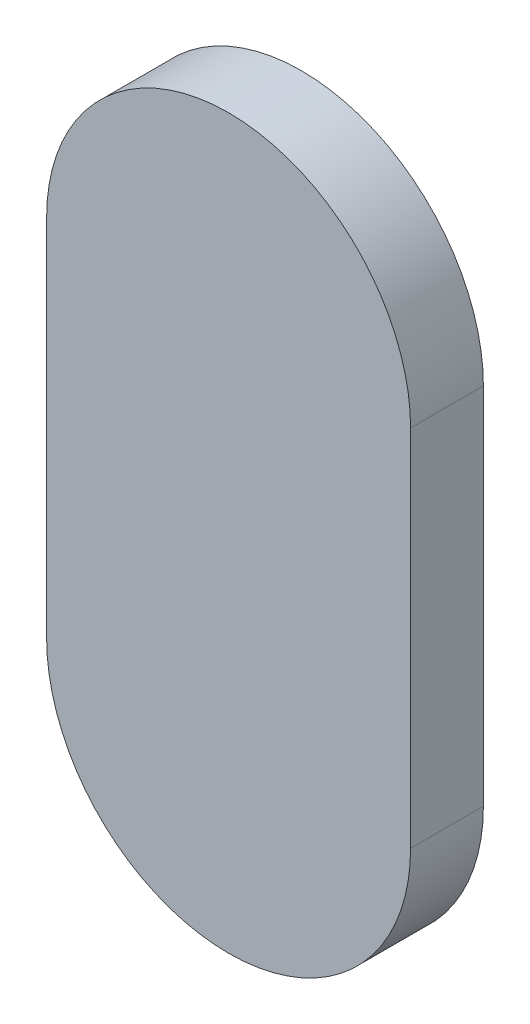
from build123d import *

# Parameters (mm, degrees)
EXTRUDE_1_DEPTH = 10


with BuildPart() as part:
    # Эскиз2 → Бобышка-Вытянуть1 (new body)
    with BuildSketch(Plane.XY):
        with BuildLine():
            Line((25, 25), (25, -25))
            ThreePointArc((25, -25), (0, -50), (-25, -25))
            Line((-25, -25), (-25, 25))
            ThreePointArc((-25, 25), (0, 50), (25, 25))
        make_face()
    extrude(amount=EXTRUDE_1_DEPTH)


solid = part.part
